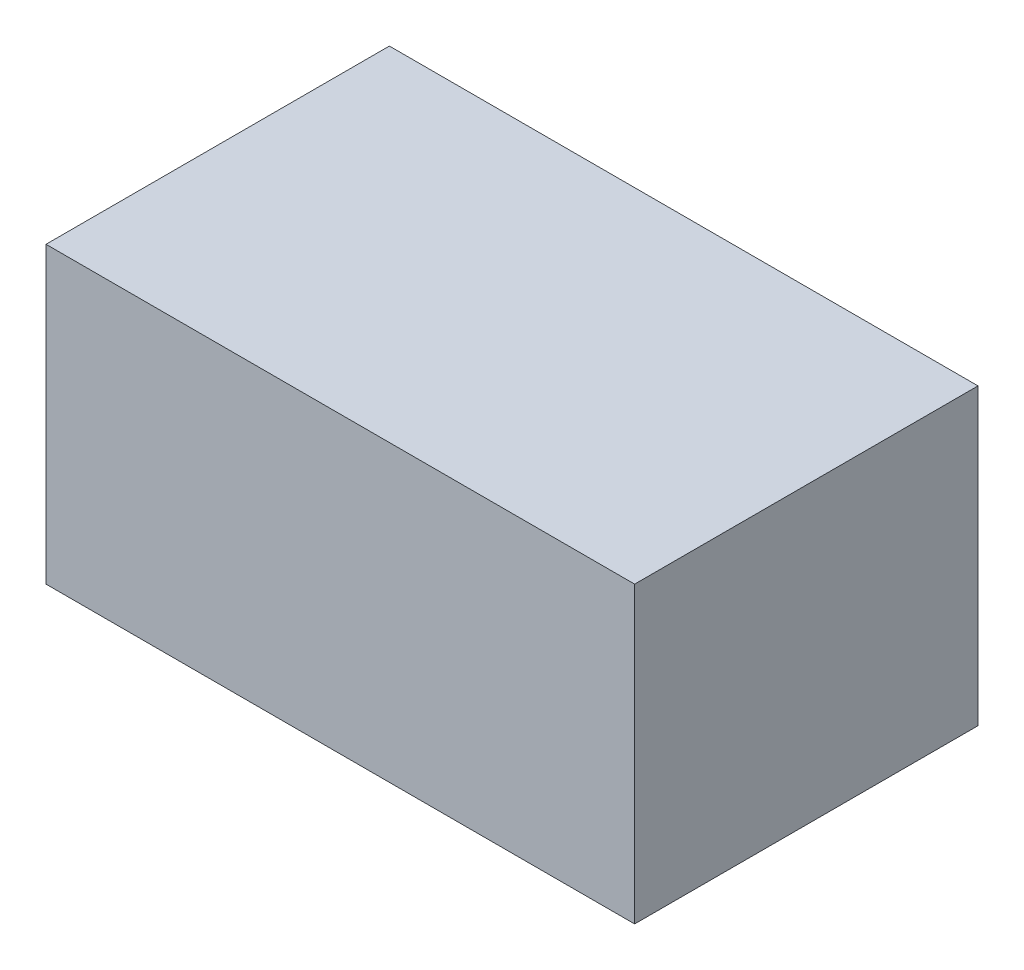
from build123d import *

# Parameters (mm, degrees)
CROQUIS1_W              = 120
CROQUIS1_H              = 70
SALIENTE_EXTRUIR1_DEPTH = 60
CROQUIS2_W              = 106
CROQUIS2_H              = 56
CORTAR_EXTRUIR1_DEPTH   = 53
CROQUIS3_W              = 43
CROQUIS3_H              = 29
CORTAR_EXTRUIR2_DEPTH   = 20
CROQUIS4_W              = 21
CROQUIS4_H              = 47.698466119
SALIENTE_EXTRUIR2_DEPTH = 32
CROQUIS5_W              = 43
CROQUIS5_H              = 29
CORTAR_EXTRUIR3_DEPTH   = 16


with BuildPart() as part:
    # Croquis1 → Saliente-Extruir1 (new body)
    with BuildSketch(Plane(origin=(0, 0, 0), x_dir=(1, 0, 0), z_dir=(0, 1, 0))):
        with Locations((16.5, -1.5)):
            Rectangle(CROQUIS1_W, CROQUIS1_H)
    extrude(amount=SALIENTE_EXTRUIR1_DEPTH)

    # Croquis2 → Cortar-Extruir1 (cut)
    with BuildSketch(Plane(origin=(0, 0, 0), x_dir=(1, 0, 0), z_dir=(0, 1, 0))):
        with Locations((16.5, -1.5)):
            Rectangle(CROQUIS2_W, CROQUIS2_H)
    extrude(amount=CORTAR_EXTRUIR1_DEPTH, mode=Mode.SUBTRACT)

    # Croquis3 → Cortar-Extruir2 (cut)
    with BuildSketch(Plane.ZY.offset(43.5)):
        with Locations((-5, 38.5)):
            Rectangle(CROQUIS3_W, CROQUIS3_H)
    extrude(amount=-CORTAR_EXTRUIR2_DEPTH, mode=Mode.SUBTRACT)

    # Croquis4 → Saliente-Extruir2 (add)
    with BuildSketch(Plane.XZ.offset(-53)):
        with Locations((-26, -2.65076694)):
            Rectangle(CROQUIS4_W, CROQUIS4_H)
    extrude(amount=SALIENTE_EXTRUIR2_DEPTH)

    # Croquis5 → Cortar-Extruir3 (cut)
    with BuildSketch(Plane.ZY.offset(36.5)):
        with Locations((-5, 38.5)):
            Rectangle(CROQUIS5_W, CROQUIS5_H)
    extrude(amount=-CORTAR_EXTRUIR3_DEPTH, mode=Mode.SUBTRACT)


solid = part.part
